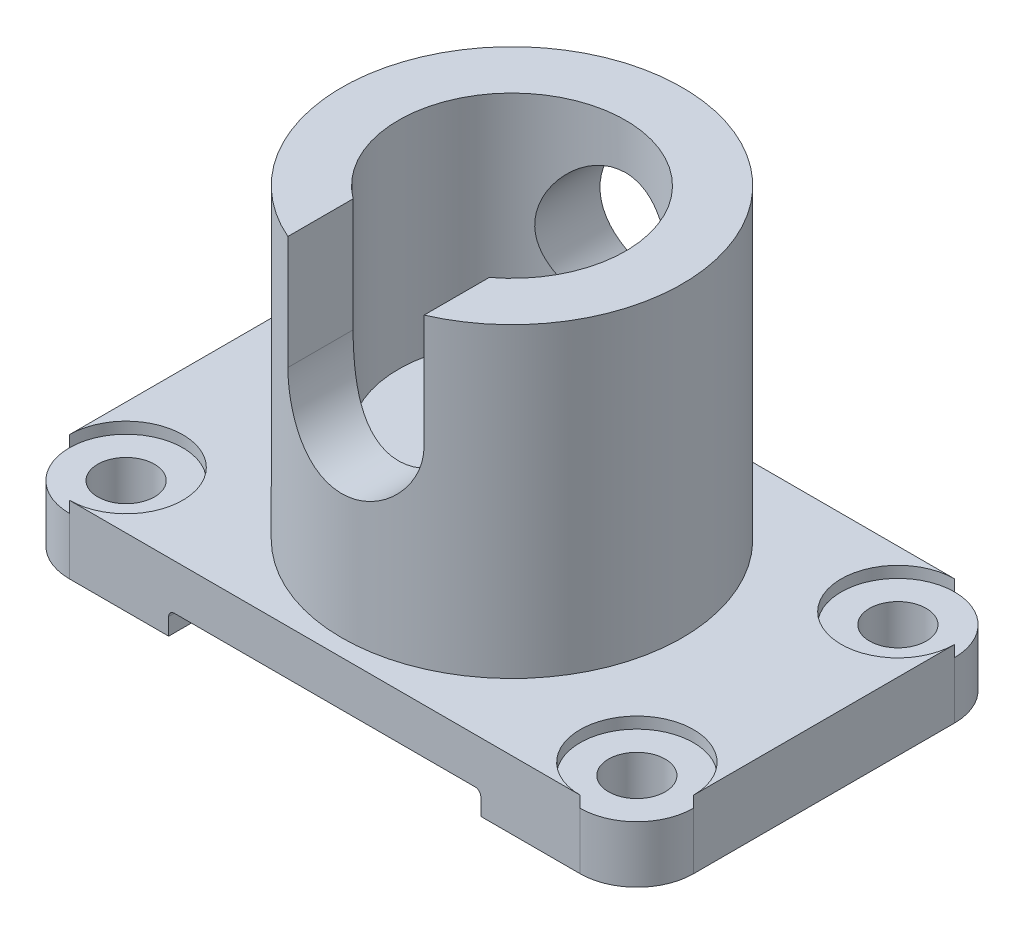
from build123d import *

# Parameters (mm, degrees)
SKETCH_1_R                      = 5
EXTRUDE_1_DEPTH                 = 12
CUT_EXTRUDE_START               = -2
SKETCH_3_R                      = 10
CUT_EXTRUDE_1_DEPTH             = 2
CUT_EXTRUDE_2_DEPTH             = 87.746757864
SKETCH_5_R                      = 30
SKETCH_5_R_2                    = 20
EXTRUDE_2_DEPTH                 = 54
SKETCH_6_R                      = 20
EXTRUDE_3_DEPTH                 = 16
CUT_EXTRUDE_4_DEPTH             = 8
SKETCH_7_3_R                    = 5
CUT_EXTRUDE_5_DEPTH             = 75.551995278
CUT_EXTRUDE_6_DEPTH             = 93.032602919
CUT_EXTRUDE_6_DEPTH_BACK        = 93.032602919
SKETCH_8_R                      = 12
CUT_EXTRUDE_7_REACH             = 94.033
CUT_EXTRUDE_7_END_RADIUS        = 12
CUT_EXTRUDE_7_DIRECTION_2_DEPTH = 93.032602919


with BuildPart() as part:
    # 草图1 → 凸台-拉伸1 (new body)
    with BuildSketch(Plane(origin=(0, 0, 0), x_dir=(1, 0, 0), z_dir=(0, 1, 0))):
        with BuildLine():
            Line((-45, -33), (45, -33))
            ThreePointArc((45, -33), (52.071067812, -30.071067812), (55, -23))
            Line((55, -23), (55, 23))
            ThreePointArc((55, 23), (52.071067812, 30.071067812), (45, 33))
            Line((45, 33), (-45, 33))
            ThreePointArc((-45, 33), (-52.071067812, 30.071067812), (-55, 23))
            Line((-55, 23), (-55, -23))
            ThreePointArc((-55, -23), (-52.071067812, -30.071067812), (-45, -33))
        make_face()
        with Locations(Location((-45, 23, 0), (0, 0, 270))):
            Circle(SKETCH_1_R, mode=Mode.SUBTRACT)
        with Locations(Location((45, 23, 0), (0, 0, 270))):
            Circle(SKETCH_1_R, mode=Mode.SUBTRACT)
        with Locations(Location((45, -23, 0), (0, 0, 270))):
            Circle(SKETCH_1_R, mode=Mode.SUBTRACT)
        with Locations(Location((-45, -23, 0), (0, 0, 270))):
            Circle(SKETCH_1_R, mode=Mode.SUBTRACT)
    extrude(amount=EXTRUDE_1_DEPTH)

    # 草图3 → 切除-拉伸1 (cut)
    with BuildSketch(Plane(origin=(0, 12, 0), x_dir=(1, 0, 0), z_dir=(0, 1, 0)).offset(CUT_EXTRUDE_START)):
        with Locations((-45, 23)):
            Circle(SKETCH_3_R)
        with Locations((-45, -23)):
            Circle(SKETCH_3_R)
        with Locations((45, -23)):
            Circle(SKETCH_3_R)
        with Locations((45, 23)):
            Circle(SKETCH_3_R)
    extrude(amount=CUT_EXTRUDE_1_DEPTH, mode=Mode.SUBTRACT)

    # 草图4 → 切除-拉伸2 (cut, through all)
    with BuildSketch(Plane.XY.offset(33)):
        with BuildLine():
            Line((-27.5, 0), (-27.5, 3))
            ThreePointArc((-27.5, 3), (-27.207106781, 3.707106781), (-26.5, 4))
            Line((-26.5, 4), (26.5, 4))
            ThreePointArc((26.5, 4), (27.207106781, 3.707106781), (27.5, 3))
            Line((27.5, 3), (27.5, 0))
            Line((27.5, 0), (-27.5, 0))
        make_face()
    extrude(amount=-CUT_EXTRUDE_2_DEPTH, mode=Mode.SUBTRACT)

    # 草图5 → 凸台-拉伸2 (add)
    with BuildSketch(Plane(origin=(0, 12, 0), x_dir=(1, 0, 0), z_dir=(0, 1, 0))):
        with Locations(Location((0, 0, 0), (0, 0, 270))):
            Circle(SKETCH_5_R)
        with Locations(Location((0, 0, 0), (0, 0, 270))):
            Circle(SKETCH_5_R_2, mode=Mode.SUBTRACT)
    extrude(amount=EXTRUDE_2_DEPTH)

    # 草图6 → 凸台-拉伸3 (add)
    with BuildSketch(Plane(origin=(0, 12, 0), x_dir=(1, 0, 0), z_dir=(0, 1, 0))):
        with Locations(Location((0, 0, 0), (0, 0, 270))):
            Circle(SKETCH_6_R)
    extrude(amount=EXTRUDE_3_DEPTH)

    # 草图7 → 切除-拉伸4 (cut)
    with BuildSketch(Plane(origin=(0, 28, 0), x_dir=(1, 0, 0), z_dir=(0, 1, 0))):
        with BuildLine():
            Line((5, -8), (5, 2))
            Line((5, 2), (10, 2))
            Line((10, 2), (10, 10))
            Line((10, 10), (-10, 10))
            Line((-10, 10), (-10, 2))
            Line((-10, 2), (-5, 2))
            Line((-5, 2), (-5, -8))
            ThreePointArc((-5, -8), (0, -3), (5, -8))
        make_face()
    extrude(amount=-CUT_EXTRUDE_4_DEPTH, mode=Mode.SUBTRACT)

    # 草图7<3> → 切除-拉伸5 (cut, through all)
    with BuildSketch(Plane(origin=(0, 28, 0), x_dir=(1, 0, 0), z_dir=(0, 1, 0))):
        with Locations(Location((0, -8, 0), (0, 0, 270))):
            Circle(SKETCH_7_3_R)
    extrude(amount=-CUT_EXTRUDE_5_DEPTH, mode=Mode.SUBTRACT)

    # 草图8 → 切除-拉伸6 (cut, two sides: drawn at the far end of the back side and taken through both)
    with BuildSketch(Plane.XY.offset(-CUT_EXTRUDE_6_DEPTH_BACK)):
        with Locations((0, 46)):
            Circle(SKETCH_8_R)
    extrude(amount=CUT_EXTRUDE_6_DEPTH + CUT_EXTRUDE_6_DEPTH_BACK, mode=Mode.SUBTRACT)

    # 切除-拉伸7: up to this cylinder (the profile starts outside it)
    cut_extrude_7_end = Plane(origin=(0, 46, 23.912941), z_dir=(0, 0, 1)) * Cylinder(CUT_EXTRUDE_7_END_RADIUS, 213.066, mode=Mode.PRIVATE)
    # 草图9 → 切除-拉伸7 (cut, up to the surface)
    with BuildSketch(Plane(origin=(0, 66, 0), x_dir=(1, 0, 0), z_dir=(0, 1, 0)), mode=Mode.PRIVATE) as cut_extrude_7_sk1:
        with BuildLine():
            Line((-12, -16), (-12, -27.49545417))
            ThreePointArc((-12, -27.49545417), (0, -30), (12, -27.49545417))
            Line((12, -27.49545417), (12, -16))
            ThreePointArc((12, -16), (0, -20), (-12, -16))
        make_face()
    cut_extrude_7_tool1 = extrude(cut_extrude_7_sk1.sketch, amount=-CUT_EXTRUDE_7_REACH, mode=Mode.PRIVATE) - cut_extrude_7_end
    add(cut_extrude_7_tool1.solids().sort_by_distance((0, 66, 23.912941))[0], mode=Mode.SUBTRACT)

    # 草图9 → 切除-拉伸7 direction 2 (cut)
    with BuildSketch(Plane(origin=(0, 66, 0), x_dir=(1, 0, 0), z_dir=(0, 1, 0))):
        with BuildLine():
            Line((-12, -16), (-12, -27.49545417))
            ThreePointArc((-12, -27.49545417), (0, -30), (12, -27.49545417))
            Line((12, -27.49545417), (12, -16))
            ThreePointArc((12, -16), (0, -20), (-12, -16))
        make_face()
    extrude(amount=CUT_EXTRUDE_7_DIRECTION_2_DEPTH, mode=Mode.SUBTRACT)


solid = part.part
